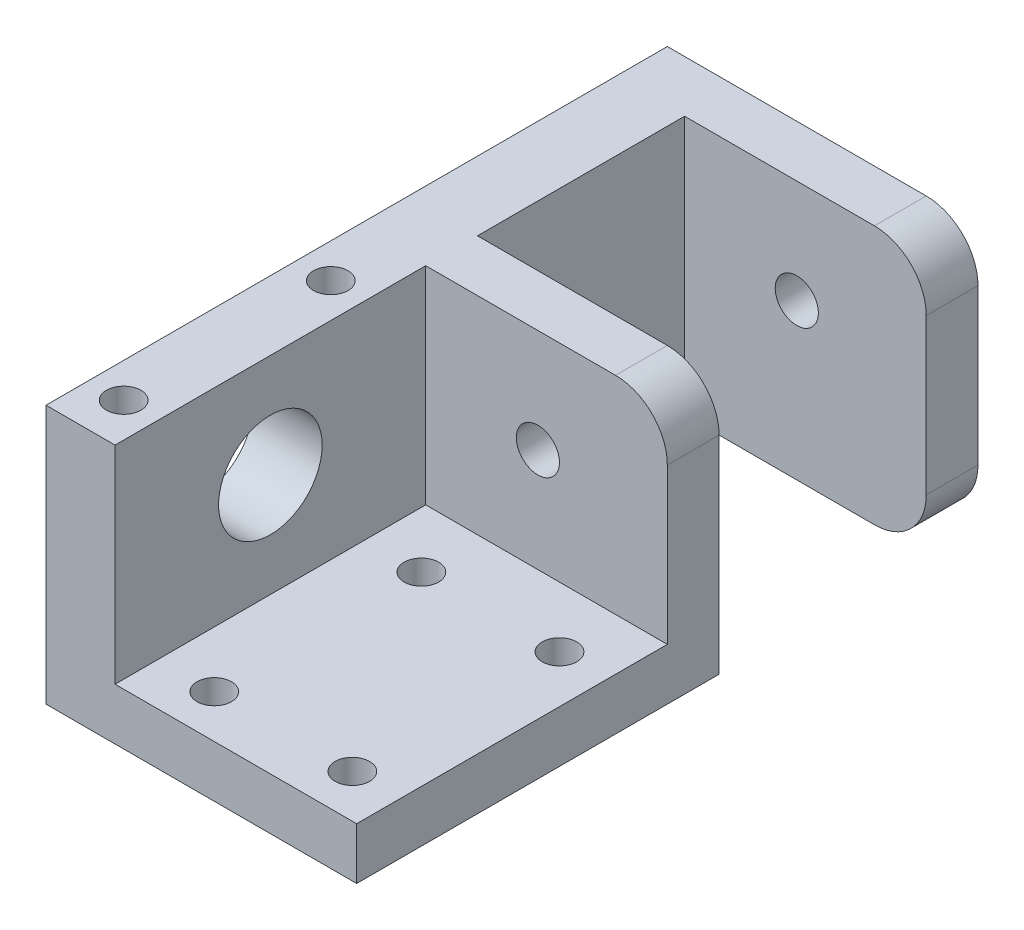
from build123d import *

# Parameters (mm, degrees)
EXTRUDE_2_DEPTH     = 15
FILLET_1_R          = 3
CUT_EXTRUDE_1_REACH = 31.547
SKETCH_4_R          = 1.25
EXTRUDE_START       = -12
SKETCH_5_W          = 18
SKETCH_5_H          = 18
EXTRUDE_3_DEPTH     = 3
SKETCH_6_W          = 4
SKETCH_6_H          = 18
EXTRUDE_5_DEPTH     = 12
SKETCH_8_R          = 3
CUT_EXTRUDE_2_DEPTH = 28.294688128
SKETCH_9_R          = 1
CUT_EXTRUDE_3_DEPTH = 29.142494559
SKETCH_10_R         = 1
CUT_EXTRUDE_4_DEPTH = 5


with BuildPart() as part:
    # 草图2 → 凸台-拉伸2 (new body)
    with BuildSketch(Plane(origin=(0, 0, 0), x_dir=(1, 0, 0), z_dir=(0, 1, 0))):
        Polygon((18, 0), (0, 0), (0, 18), (18, 18), (18, 15), (4, 15), (4, 3), (18, 3), align=None)
    extrude(amount=EXTRUDE_2_DEPTH)

    # 圆角1
    fillet_1_edges = [part.edges().sort_by_distance(p)[0] for p in [
        (18, 0, -16.5),
        (18, 15, -16.5),
        (18, 15, -1.5),
    ]]
    fillet(fillet_1_edges, radius=FILLET_1_R)

    # 切除-拉伸1: up to this face of the body (flat: up to its plane)
    cut_extrude_1_end = Plane(part.part.faces().sort_by_distance((8.939983645, 7.450791047, 0))[0])
    # 草图4 → 切除-拉伸1 (cut, up to the picked face)
    with BuildSketch(Plane(origin=(0, 0, -18), x_dir=(-1, 0, 0), z_dir=(0, 0, -1)), mode=Mode.PRIVATE) as cut_extrude_1_sk1:
        with Locations((-10.5, 9)):
            Circle(SKETCH_4_R)
    cut_extrude_1_tool1 = split(extrude(cut_extrude_1_sk1.sketch, amount=-CUT_EXTRUDE_1_REACH, mode=Mode.PRIVATE), bisect_by=cut_extrude_1_end, keep=Keep.BOTH, mode=Mode.PRIVATE)
    add(cut_extrude_1_tool1.solids().sort_by(Axis((10.5, 9, -18), (0, 0, 1)))[0], mode=Mode.SUBTRACT)

    # 草图5 → 凸台-拉伸3 (add)
    with BuildSketch(Plane(origin=(0, 15, 0), x_dir=(1, 0, 0), z_dir=(0, 1, 0)).offset(EXTRUDE_START)):
        with Locations((9, -9)):
            Rectangle(SKETCH_5_W, SKETCH_5_H)
    extrude(amount=-EXTRUDE_3_DEPTH)

    # 草图6 → 凸台-拉伸5 (add)
    with BuildSketch(Plane(origin=(0, 3, 0), x_dir=(1, 0, 0), z_dir=(0, 1, 0))):
        with Locations((2, -9)):
            Rectangle(SKETCH_6_W, SKETCH_6_H)
    extrude(amount=EXTRUDE_5_DEPTH)

    # 草图8 → 切除-拉伸2 (cut, through all)
    with BuildSketch(Plane(origin=(4, 0, 0), x_dir=(0, 0, -1), z_dir=(1, 0, 0))):
        with Locations((-9, 9)):
            Circle(SKETCH_8_R)
    extrude(amount=-CUT_EXTRUDE_2_DEPTH, mode=Mode.SUBTRACT)

    # 草图9 → 切除-拉伸3 (cut, through all)
    with BuildSketch(Plane(origin=(0, 3, 0), x_dir=(1, 0, 0), z_dir=(0, 1, 0))):
        with Locations(Location((7.25, -15.5, 0), (0, 0, 270))):
            Circle(SKETCH_9_R)
        with Locations(Location((15.25, -15.5, 0), (0, 0, 270))):
            Circle(SKETCH_9_R)
        with Locations(Location((7.25, -3.5, 0), (0, 0, 270))):
            Circle(SKETCH_9_R)
        with Locations(Location((15.25, -3.5, 0), (0, 0, 270))):
            Circle(SKETCH_9_R)
    extrude(amount=-CUT_EXTRUDE_3_DEPTH, mode=Mode.SUBTRACT)

    # 草图10 → 切除-拉伸4 (cut)
    with BuildSketch(Plane(origin=(0, 15, 0), x_dir=(1, 0, 0), z_dir=(0, 1, 0))):
        with Locations(Location((2, -15.5, 0), (0, 0, 270))):
            Circle(SKETCH_10_R)
        with Locations(Location((2, -3.5, 0), (0, 0, 270))):
            Circle(SKETCH_10_R)
    extrude(amount=-CUT_EXTRUDE_4_DEPTH, mode=Mode.SUBTRACT)


solid = part.part
